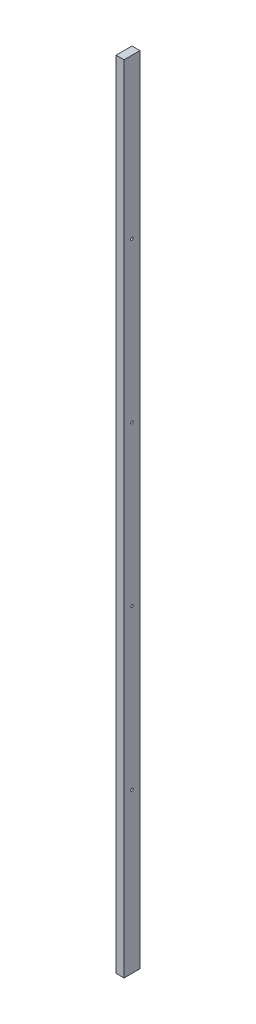
from build123d import *

# Parameters (mm, degrees)
SKETCH_1_W          = 25
SKETCH_1_H          = 50
EXTRUDE_1_DEPTH     = 2500
SKETCH_2_R          = 4
CUT_EXTRUDE_1_DEPTH = 100


with BuildPart() as part:
    # Эскиз1 → Бобышка-Вытянуть1 (new body)
    with BuildSketch(Plane(origin=(0, 0, 0), x_dir=(1, 0, 0), z_dir=(0, 1, 0))):
        Rectangle(SKETCH_1_W, SKETCH_1_H)
    extrude(amount=EXTRUDE_1_DEPTH)

    # Эскиз2 → Вырез-Вытянуть1 (cut)
    with BuildSketch(Plane(origin=(12.5, 0, 0), x_dir=(0, 0, -1), z_dir=(1, 0, 0))):
        with Locations((0, 500)):
            Circle(SKETCH_2_R)
        with Locations((0, 1000)):
            Circle(SKETCH_2_R)
        with Locations((0, 1500)):
            Circle(SKETCH_2_R)
        with Locations((0, 2000)):
            Circle(SKETCH_2_R)
    extrude(amount=-CUT_EXTRUDE_1_DEPTH, mode=Mode.SUBTRACT)


solid = part.part
